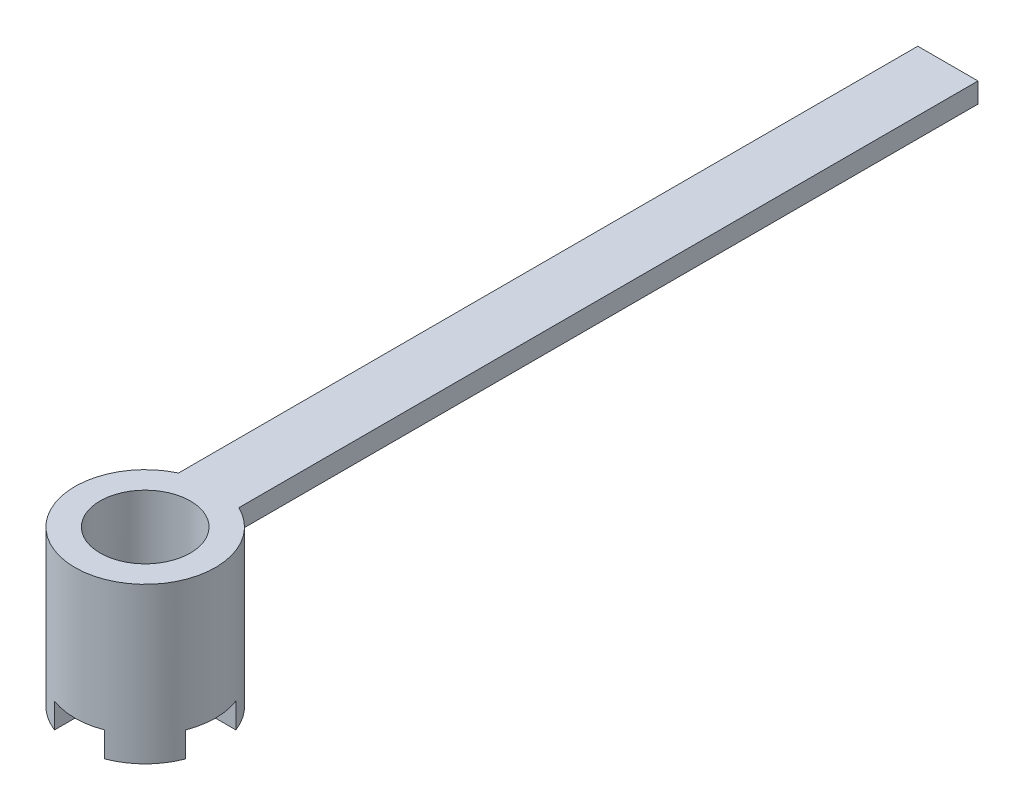
from build123d import *

# Parameters (mm, degrees)
BOSS_EXTRUDE1_DEPTH = 2.54
BOSS_EXTRUDE2_START = 17.145
SKETCH3_R           = 8.89
SKETCH3_R_2         = 5.715
BOSS_EXTRUDE2_DEPTH = 17.145
CUT_EXTRUDE1_DEPTH  = 3.175


with BuildPart() as part:
    # Sketch2 → Boss-Extrude1 (new body)
    with BuildSketch(Plane(origin=(0, 0, 0), x_dir=(1, 0, 0), z_dir=(0, 1, 0))):
        with BuildLine():
            Line((3.81, 8.032185257), (3.81, 101.6))
            Line((3.81, 101.6), (-3.81, 101.6))
            Line((-3.81, 101.6), (-3.81, 8.032185257))
            ThreePointArc((-3.81, 8.032185257), (0, 8.89), (3.81, 8.032185257))
        make_face()
        with BuildLine():
            ThreePointArc((8.89, 0), (7.513421325, 4.751904881), (3.81, 8.032185257))
            Line((3.81, 8.032185257), (3.81, 4.259709497))
            ThreePointArc((3.81, 4.259709497), (5.21705736, 2.33313898), (5.715, 0))
            ThreePointArc((5.715, 0), (-2.33313898, -5.21705736), (-3.81, 4.259709497))
            Line((-3.81, 4.259709497), (-3.81, 8.032185257))
            ThreePointArc((-3.81, 8.032185257), (-4.751904881, -7.513421325), (8.89, 0))
        make_face()
        with BuildLine():
            Line((3.81, 4.259709497), (3.81, 8.032185257))
            ThreePointArc((3.81, 8.032185257), (0, 8.89), (-3.81, 8.032185257))
            Line((-3.81, 8.032185257), (-3.81, 4.259709497))
            ThreePointArc((-3.81, 4.259709497), (0, 5.715), (3.81, 4.259709497))
        make_face()
    extrude(amount=BOSS_EXTRUDE1_DEPTH)

    # Sketch3 → Boss-Extrude2 (add)
    with BuildSketch(Plane.XZ.offset(BOSS_EXTRUDE2_START)):
        with Locations(Location((0, 0, 0), (0, 0, 270))):
            Circle(SKETCH3_R)
        with Locations(Location((0, 0, 0), (0, 0, 270))):
            Circle(SKETCH3_R_2, mode=Mode.SUBTRACT)
    extrude(amount=-BOSS_EXTRUDE2_DEPTH)

    # Sketch4 → Cut-Extrude1 (cut)
    with BuildSketch(Plane.XZ.offset(17.145)):
        with BuildLine():
            Line((-4.751904881, 3.175), (-8.303702487, 3.175))
            ThreePointArc((-8.303702487, 3.175), (-8.89, 0), (-8.303702487, -3.175))
            Line((-8.303702487, -3.175), (-4.751904881, -3.175))
            ThreePointArc((-4.751904881, -3.175), (-5.715, 0), (-4.751904881, 3.175))
        make_face()
        with BuildLine():
            ThreePointArc((8.89, 0), (8.742196953, 1.614339631), (8.303702487, 3.175))
            Line((8.303702487, 3.175), (4.751904881, 3.175))
            ThreePointArc((4.751904881, 3.175), (5.468928661, 1.658928661), (5.715, 0))
            ThreePointArc((5.715, 0), (5.468928661, -1.658928661), (4.751904881, -3.175))
            Line((4.751904881, -3.175), (8.303702487, -3.175))
            ThreePointArc((8.303702487, -3.175), (8.742196953, -1.614339631), (8.89, 0))
        make_face()
        with BuildLine():
            ThreePointArc((3.175, 8.303702487), (0, 8.89), (-3.175, 8.303702487))
            Line((-3.175, 8.303702487), (-3.175, 4.751904881))
            ThreePointArc((-3.175, 4.751904881), (0, 5.715), (3.175, 4.751904881))
            Line((3.175, 4.751904881), (3.175, 8.303702487))
        make_face()
        with BuildLine():
            Line((-3.175, -4.751904881), (-3.175, -8.303702487))
            ThreePointArc((-3.175, -8.303702487), (0, -8.89), (3.175, -8.303702487))
            Line((3.175, -8.303702487), (3.175, -4.751904881))
            ThreePointArc((3.175, -4.751904881), (0, -5.715), (-3.175, -4.751904881))
        make_face()
    extrude(amount=-CUT_EXTRUDE1_DEPTH, mode=Mode.SUBTRACT)


solid = part.part
